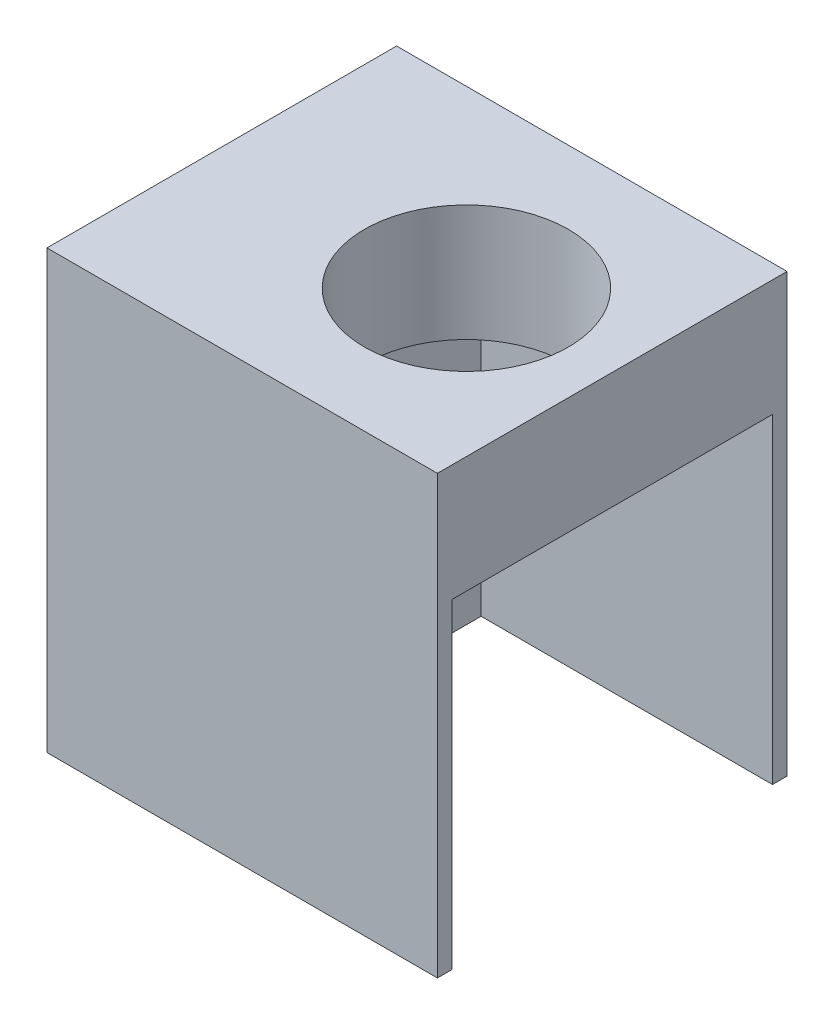
from build123d import *

# Parameters (mm, degrees)
SKETCH_2_W          = 13.4
SKETCH_2_H          = 12
SKETCH_2_R          = 3.5
EXTRUDE_2_DEPTH     = 15
SKETCH_3_W          = 10
SKETCH_3_H          = 11
CUT_EXTRUDE_1_DEPTH = 11


with BuildPart() as part:
    # 草图2 → 凸台-拉伸2 (new body)
    with BuildSketch(Plane(origin=(0, 0, 0), x_dir=(1, 0, 0), z_dir=(0, 1, 0))):
        with Locations((6.7, -6)):
            Rectangle(SKETCH_2_W, SKETCH_2_H)
        with Locations(Location((8.395740059, -6, 0), (0, 0, 270))):
            Circle(SKETCH_2_R, mode=Mode.SUBTRACT)
    extrude(amount=EXTRUDE_2_DEPTH)

    # 草图3 → 切除-拉伸1 (cut)
    with BuildSketch(Plane.XZ):
        with Locations((8.4, 6)):
            Rectangle(SKETCH_3_W, SKETCH_3_H)
    extrude(amount=-CUT_EXTRUDE_1_DEPTH, mode=Mode.SUBTRACT)


solid = part.part
